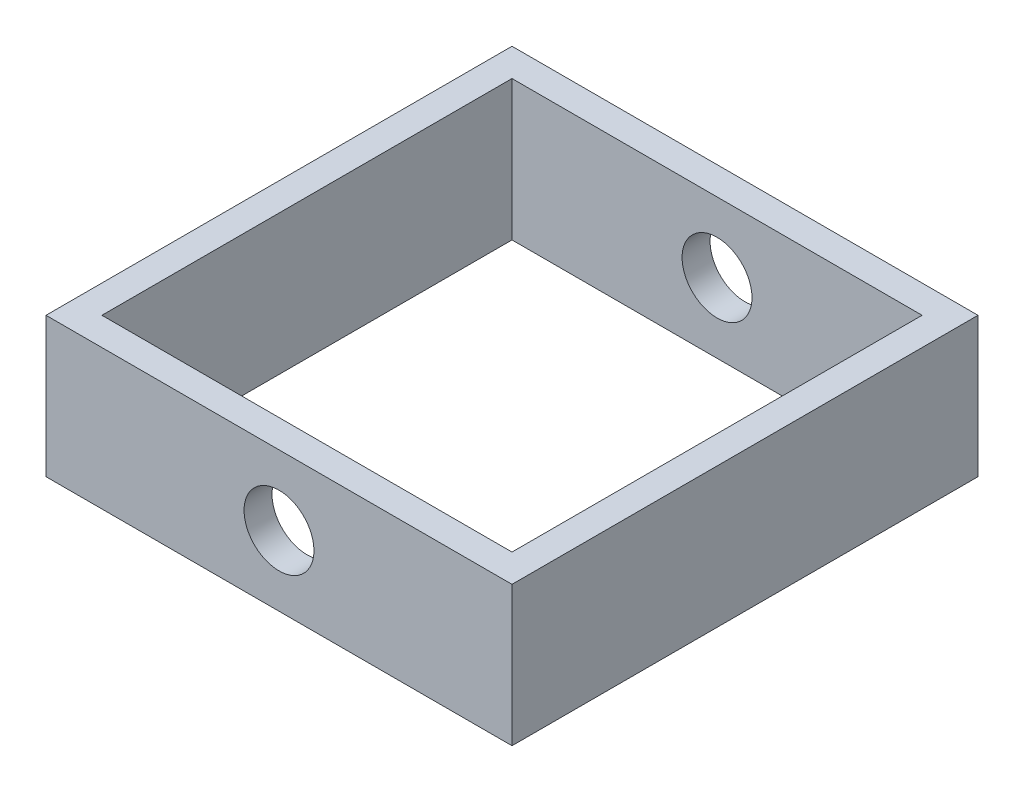
from build123d import *

# Parameters (mm, degrees)
SKETCH1_W           = 100
SKETCH1_H           = 100
SKETCH1_W_2         = 88
SKETCH1_H_2         = 88
BOSS_EXTRUDE1_DEPTH = 30
SKETCH2_R           = 7.5
CUT_EXTRUDE1_DEPTH  = 145.568322948


with BuildPart() as part:
    # Sketch1 → Boss-Extrude1 (new body)
    with BuildSketch(Plane(origin=(0, 0, 0), x_dir=(1, 0, 0), z_dir=(0, 1, 0))):
        with Locations((50, 50)):
            Rectangle(SKETCH1_W, SKETCH1_H)
        with Locations((50, 50)):
            Rectangle(SKETCH1_W_2, SKETCH1_H_2, mode=Mode.SUBTRACT)
    extrude(amount=BOSS_EXTRUDE1_DEPTH)

    # Sketch2 → Cut-Extrude1 (cut, through all)
    with BuildSketch(Plane.XY):
        with Locations((50, 15)):
            Circle(SKETCH2_R)
    extrude(amount=-CUT_EXTRUDE1_DEPTH, mode=Mode.SUBTRACT)


solid = part.part
